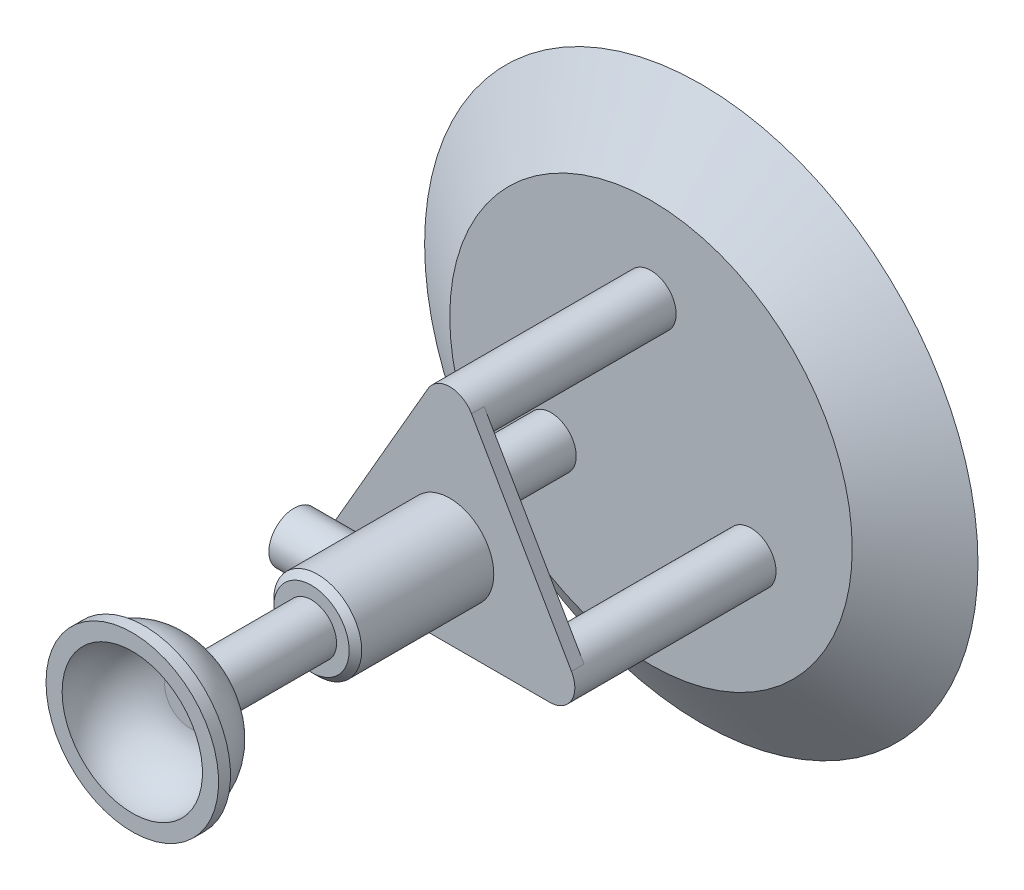
from build123d import *

# Parameters (mm, degrees)
SKETCH3_R           = 2
BOSS_EXTRUDE1_DEPTH = 15
BOSS_EXTRUDE2_DEPTH = 1
SKETCH6_R           = 3.5
BOSS_EXTRUDE3_DEPTH = 11
SKETCH7_R           = 2
BOSS_EXTRUDE4_DEPTH = 9
CHAMFER2_SIZE       = 0.5
SKETCH9_R           = 2
BOSS_EXTRUDE5_DEPTH = 7


with BuildPart() as part:
    # Sketch2 → Revolve1 (revolve)
    with BuildSketch(Plane(origin=(0, 0, 0), x_dir=(0, 0, -1), z_dir=(1, 0, 0)), mode=Mode.PRIVATE) as revolve1_sk:
        Polygon((0, 0), (0, 22), (-4, 16), (-4, 0), align=None)
    revolve(revolve1_sk.sketch.rotate(Axis((0, 0, 4), (0, 0, -1)), 90), axis=Axis((0, 0, 4), (0, 0, -1)))

    # Sketch3 → Boss-Extrude1 (add)
    with BuildSketch(Plane.XY.offset(4)):
        with Locations(Location((7.94445625, -4.586733955, 0), (0, 0, 180))):
            Circle(SKETCH3_R)
        with Locations(Location((-7.94445625, -4.586733955, 0), (0, 0, 180))):
            Circle(SKETCH3_R)
        with Locations(Location((0, 9.173467909, 0), (0, 0, 180))):
            Circle(SKETCH3_R)
    extrude(amount=BOSS_EXTRUDE1_DEPTH)

    # Sketch4 → Boss-Extrude2 (add)
    with BuildSketch(Plane.XY.offset(19)):
        with BuildLine():
            Line((1.732050808, 10.173467909), (9.676507058, -3.586733955))
            ThreePointArc((9.676507058, -3.586733955), (9.676507058, -5.586733955), (7.94445625, -6.586733955))
            Line((7.94445625, -6.586733955), (-7.94445625, -6.586733955))
            ThreePointArc((-7.94445625, -6.586733955), (-9.676507058, -5.586733955), (-9.676507058, -3.586733955))
            Line((-9.676507058, -3.586733955), (-1.732050808, 10.173467909))
            ThreePointArc((-1.732050808, 10.173467909), (0, 11.173467909), (1.732050808, 10.173467909))
        make_face()
    extrude(amount=BOSS_EXTRUDE2_DEPTH)

    # Sketch6 → Boss-Extrude3 (add)
    with BuildSketch(Plane.XY.offset(20)):
        Circle(SKETCH6_R)
    extrude(amount=BOSS_EXTRUDE3_DEPTH)

    # Sketch7 → Boss-Extrude4 (add)
    with BuildSketch(Plane.XY.offset(31)):
        Circle(SKETCH7_R)
    extrude(amount=BOSS_EXTRUDE4_DEPTH)

    # Chamfer2
    chamfer2_edges = [part.edges().sort_by_distance(p)[0] for p in [
        (-3.5, 0, 31),
    ]]
    chamfer(chamfer2_edges, length=CHAMFER2_SIZE)

    # Sketch8 → Revolve2 (revolve)
    with BuildSketch(Plane(origin=(0, 0, 0), x_dir=(1, 0, 0), z_dir=(0, 1, 0)), mode=Mode.PRIVATE) as revolve2_sk:
        with BuildLine():
            Line((0, -40), (2, -40))
            ThreePointArc((2, -40), (4.985127596, -41.278519641), (6.191881653, -44.293373514))
            Line((6.191881653, -44.293373514), (6.861274265, -44.293373514))
            Line((6.861274265, -44.293373514), (6.861274265, -45.241679714))
            Line((6.861274265, -45.241679714), (5.57827176, -45.241679714))
            ThreePointArc((5.57827176, -45.241679714), (4.736480165, -42.213503946), (2, -40.66749687))
            Line((2, -40.66749687), (0, -40.66749687))
            Line((0, -40.66749687), (0, -40))
        make_face()
    revolve(revolve2_sk.sketch.rotate(Axis((0, 0, 40), (0, 0, 1)), 180), axis=Axis((0, 0, 40), (0, 0, 1)))

    # Sketch9 → Boss-Extrude5 (add)
    with BuildSketch(Plane(origin=(0, 0, 0), x_dir=(0, 0, -1), z_dir=(1, 0, 0))):
        with Locations((-25.382084378, 0)):
            Circle(SKETCH9_R)
    extrude(amount=-BOSS_EXTRUDE5_DEPTH)


solid = part.part
